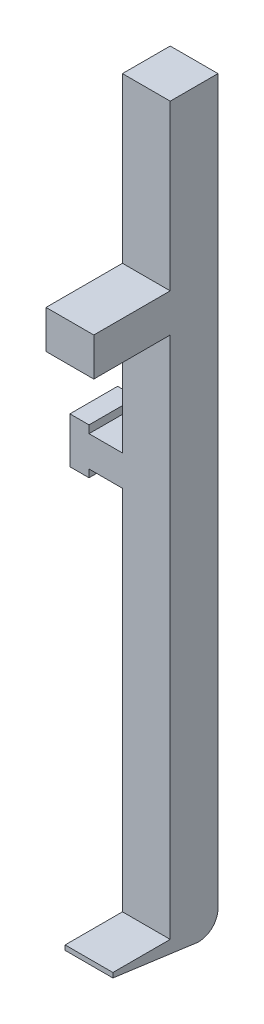
from build123d import *

# Parameters (mm, degrees)
SKETCH1_W            = 2.5
SKETCH1_H            = 2.5
BOSS_EXTRUDE1_DEPTH  = 38
SKETCH2_W            = 2.5
SKETCH2_H            = 1
BOSS_EXTRUDE2_DEPTH  = 3
CUT_EXTRUDE1_DEPTH   = 2.5
FILLET1_R            = 1
BOSS_EXTRUDE4_DEPTH  = 2.5
SKETCH6_W            = 2.5
SKETCH6_H            = 2.5
BOSS_EXTRUDE5_DEPTH  = 1
SKETCH10_W           = 2.5
SKETCH10_H           = 2
BOSS_EXTRUDE10_DEPTH = 4


with BuildPart() as part:
    # Sketch1 → Boss-Extrude1 (new body)
    with BuildSketch(Plane(origin=(0, 0, 0), x_dir=(1, 0, 0), z_dir=(0, 1, 0))):
        Rectangle(SKETCH1_W, SKETCH1_H)
    extrude(amount=BOSS_EXTRUDE1_DEPTH)

    # Sketch2 → Boss-Extrude2 (add)
    with BuildSketch(Plane.XY.offset(1.25)):
        with Locations((0, 0.5)):
            Rectangle(SKETCH2_W, SKETCH2_H)
    extrude(amount=BOSS_EXTRUDE2_DEPTH)

    # Sketch3 → Cut-Extrude1 (cut)
    with BuildSketch(Plane(origin=(1.25, 0, 0), x_dir=(0, 0, -1), z_dir=(1, 0, 0))):
        Polygon((-4.25, 0), (-4.25, 0.75), (1.25, 0), align=None)
    extrude(amount=-CUT_EXTRUDE1_DEPTH, mode=Mode.SUBTRACT)

    # Fillet1
    fillet1_edges = [part.edges().sort_by_distance(p)[0] for p in [
        (0, 0, -1.25),
    ]]
    fillet(fillet1_edges, radius=FILLET1_R)

    # Sketch4 → Boss-Extrude4 (add)
    with BuildSketch(Plane(origin=(0, 0, 1.25), x_dir=(-1, 0, 0), z_dir=(0, 0, -1))):
        Polygon((1.25, 20.2), (1.25, 21.8), (3, 21.8), (3, 22.2), (4, 22.2), (4, 19.8), (3, 19.8), (3, 20.2), align=None)
    extrude(amount=BOSS_EXTRUDE4_DEPTH)

    # Sketch6 → Boss-Extrude5 (add)
    with BuildSketch(Plane(origin=(0, 38, 0), x_dir=(1, 0, 0), z_dir=(0, 1, 0))):
        Rectangle(SKETCH6_W, SKETCH6_H)
    extrude(amount=BOSS_EXTRUDE5_DEPTH)

    # Sketch10 → Boss-Extrude10 (add)
    with BuildSketch(Plane.XY.offset(1.25)):
        with Locations((0, 29.4)):
            Rectangle(SKETCH10_W, SKETCH10_H)
    extrude(amount=BOSS_EXTRUDE10_DEPTH)


solid = part.part
